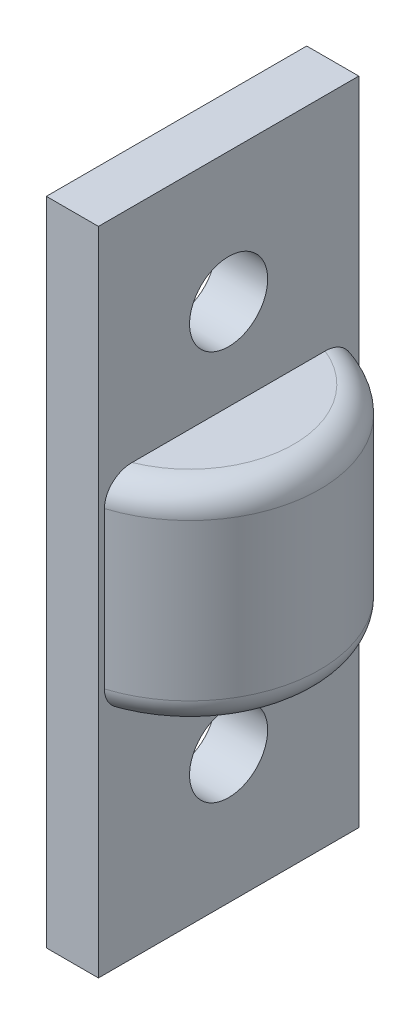
from build123d import *

# Parameters (mm, degrees)
SKETCH1_W           = 10
SKETCH1_H           = 25
SKETCH1_R           = 1.5
BOSS_EXTRUDE1_DEPTH = 2
BOSS_EXTRUDE2_START = -56
BOSS_EXTRUDE2_DEPTH = 8
FILLET1_R           = 1


with BuildPart() as part:
    # Sketch1 → Boss-Extrude1 (new body)
    with BuildSketch(Plane(origin=(-20.145, 0, 0), x_dir=(0, 0, -1), z_dir=(1, 0, 0))):
        with Locations((0, 40)):
            Rectangle(SKETCH1_W, SKETCH1_H)
        with Locations((0, 47.5)):
            Circle(SKETCH1_R, mode=Mode.SUBTRACT)
        with Locations((0, 32.5)):
            Circle(SKETCH1_R, mode=Mode.SUBTRACT)
    extrude(amount=BOSS_EXTRUDE1_DEPTH)

    # Sketch2 → Boss-Extrude2 (add)
    with BuildSketch(Plane(origin=(0, 100, 0), x_dir=(1, 0, 0), z_dir=(0, 1, 0)).offset(BOSS_EXTRUDE2_START)):
        with BuildLine():
            Line((-19.645, 5), (-19.645, -5))
            ThreePointArc((-19.645, -5), (-14.645, 0), (-19.645, 5))
        make_face()
    extrude(amount=-BOSS_EXTRUDE2_DEPTH)

    # Fillet1
    fillet1_edges = [part.edges().sort_by_distance(p)[0] for p in [
        (-14.645, 36, 0),
        (-14.645, 44, 0),
    ]]
    fillet(fillet1_edges, radius=FILLET1_R)


solid = part.part
